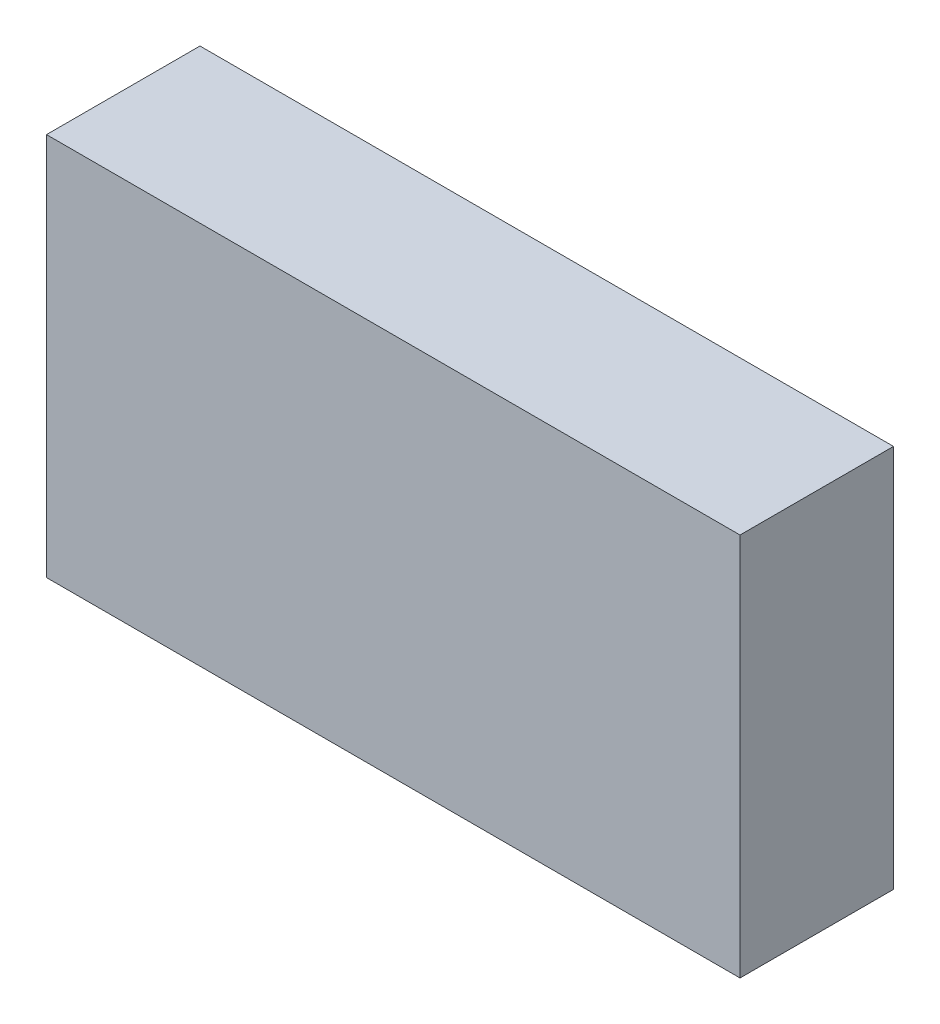
from build123d import *

# Parameters (mm, degrees)
SKETCH1_W           = 235
SKETCH1_H           = 130
BOSS_EXTRUDE1_DEPTH = 26


with BuildPart() as part:
    # Sketch1 → Boss-Extrude1 (new, symmetric)
    with BuildSketch(Plane.XY):
        Rectangle(SKETCH1_W, SKETCH1_H)
    extrude(amount=BOSS_EXTRUDE1_DEPTH, both=True)


solid = part.part
